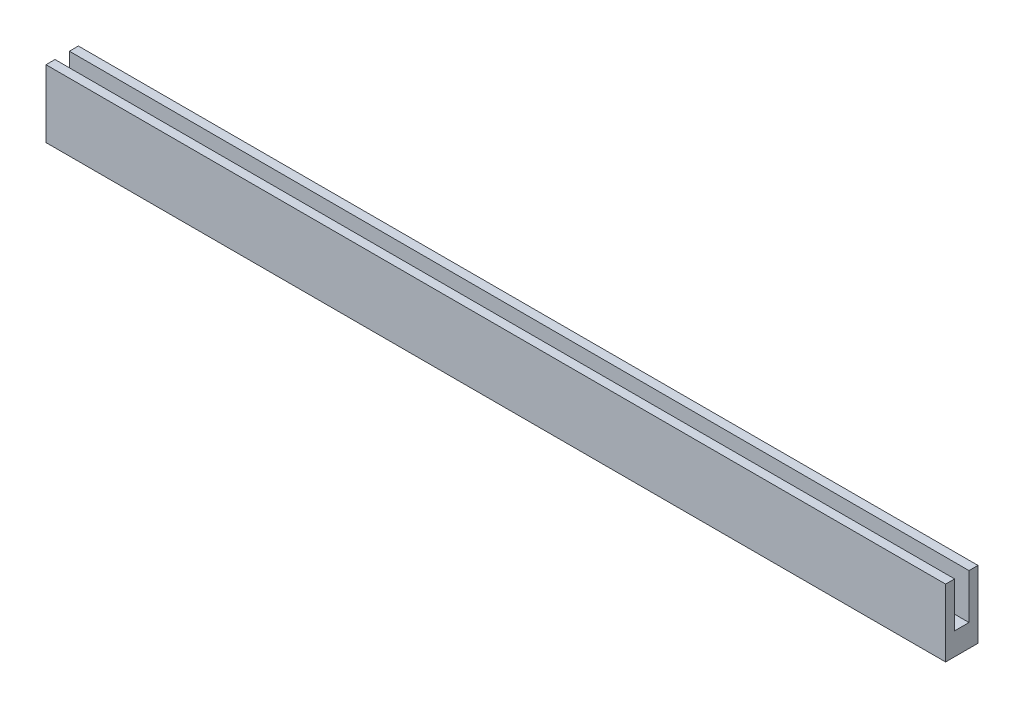
from build123d import *

# Parameters (mm, degrees)
BOSS_EXTRUDE2_DEPTH = 200


with BuildPart() as part:
    # Sketch1 → Boss-Extrude2 (new body)
    with BuildSketch(Plane(origin=(0, 0, 0), x_dir=(0, 0, -1), z_dir=(1, 0, 0))):
        Polygon((-7.2, 0), (-2, 0), (-2, 5), (-5.2, 5), (-5.2, 15), (-7.2, 15), align=None)
        Polygon((0, 0), (0, 9.691340444), (0, 15), (-2, 15), (-2, 5), (-2, 0), align=None)
    extrude(amount=BOSS_EXTRUDE2_DEPTH)


solid = part.part
